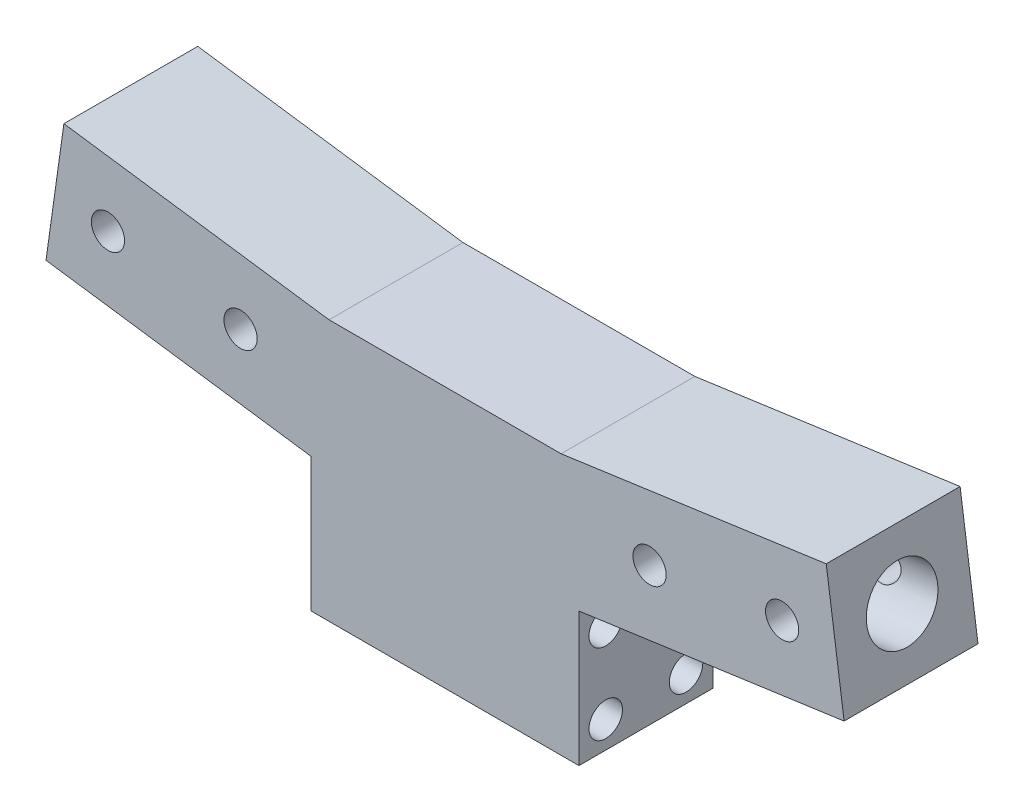
from build123d import *

# Parameters (mm, degrees)
SKETCH1_W           = 50
SKETCH1_H           = 25
BOSS_EXTRUDE1_DEPTH = 25
BOSS_EXTRUDE2_DEPTH = 25
SKETCH4_R           = 6.625
CUT_EXTRUDE1_DEPTH  = 50
SKETCH5_R           = 3.1
CUT_EXTRUDE2_DEPTH  = 90.697578477
SKETCH6_R           = 3.125
CUT_EXTRUDE3_DEPTH  = 112.338788217


with BuildPart() as part:
    # Sketch1 → Boss-Extrude1 (new body)
    with BuildSketch(Plane.XY):
        Rectangle(SKETCH1_W, SKETCH1_H)
    extrude(amount=BOSS_EXTRUDE1_DEPTH)

    # Sketch3 → Boss-Extrude2 (add)
    with BuildSketch(Plane.XY.offset(25)):
        Polygon((-25, 12.5), (-74.513403437, 19.458655048), (-71.173249014, 43.225088698), (-21.659845577, 36.26643365), (21.659845577, 36.26643365), (71.173249014, 43.225088698), (74.513403437, 19.458655048), (25, 12.5), align=None)
    extrude(amount=-BOSS_EXTRUDE2_DEPTH)

    # Sketch4 → Cut-Extrude1 (cut)
    with BuildSketch(Plane(origin=(-75.75190811, 10.646236396, 0), x_dir=(0, 0, 1), z_dir=(-0.9902680687415705, 0.13917310096006502, 0))):
        with Locations(Location((12.5, 20.899023335, 0), (0, 0, 270))):
            Circle(SKETCH4_R)
    cut_extrude1 = extrude(amount=-CUT_EXTRUDE1_DEPTH, mode=Mode.SUBTRACT)

    # Mirror1: Cut-Extrude1 across plane
    add(cut_extrude1.mirror(Plane(origin=(0, 0, 0), x_dir=(0, 0, 1), z_dir=(1, 0, 0))), mode=Mode.SUBTRACT)

    # Sketch5 → Cut-Extrude2 (cut, through all)
    with BuildSketch(Plane.XY.offset(25)):
        with Locations((-62.940645538, 29.950140863)):
            Circle(SKETCH5_R)
        with Locations((-38.18394382, 26.470813339)):
            Circle(SKETCH5_R)
        with Locations((38.18394382, 26.470813339)):
            Circle(SKETCH5_R)
        with Locations((62.940645538, 29.950140863)):
            Circle(SKETCH5_R)
    extrude(amount=-CUT_EXTRUDE2_DEPTH, mode=Mode.SUBTRACT)

    # Sketch6 → Cut-Extrude3 (cut, through all)
    with BuildSketch(Plane(origin=(25, 0, 0), x_dir=(0, 0, -1), z_dir=(1, 0, 0))):
        with Locations((-20, 7.5)):
            Circle(SKETCH6_R)
        with Locations((-5, 7.5)):
            Circle(SKETCH6_R)
        with Locations((-5, -7.5)):
            Circle(SKETCH6_R)
        with Locations((-20, -7.5)):
            Circle(SKETCH6_R)
    extrude(amount=-CUT_EXTRUDE3_DEPTH, mode=Mode.SUBTRACT)


solid = part.part
